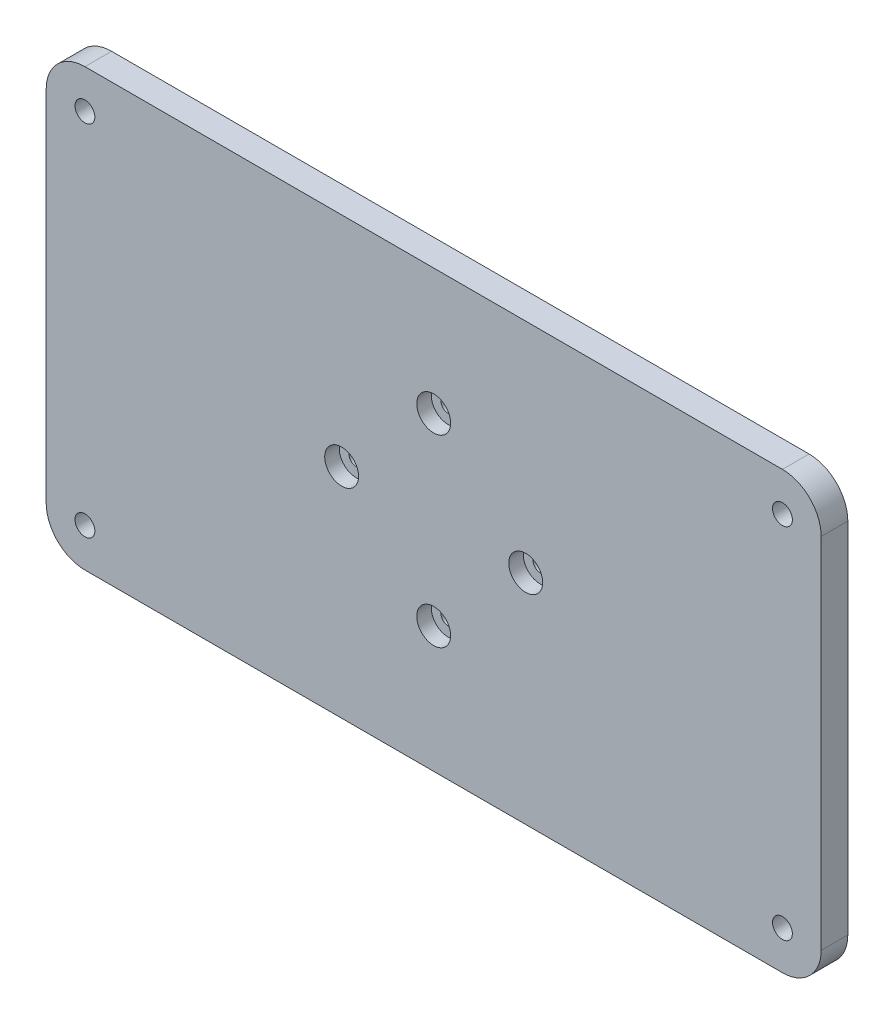
from build123d import *

# Parameters (mm, degrees)
SKETCH_1_R          = 28.7
SKETCH_1_R_2        = 1.5
EXTRUDE_1_DEPTH     = 3
EXTRUDE_START       = -48
SKETCH_2_R          = 34.7
SKETCH_2_R_2        = 28.7
EXTRUDE_2_DEPTH     = 48
SKETCH_3_W          = 12
SKETCH_3_H          = 23
CUT_EXTRUDE_1_DEPTH = 10
FILLET_1_R          = 2
SKETCH_4_W          = 30
SKETCH_4_H          = 25
CUT_EXTRUDE_2_DEPTH = 96.094431221
FILLET_2_R          = 2
SKETCH_5_W          = 160
SKETCH_5_H          = 90
SKETCH_5_R          = 34.7
SKETCH_5_R_2        = 1.5
EXTRUDE_3_DEPTH     = 5.5
SKETCH_7_R          = 2.05
CUT_EXTRUDE_3_DEPTH = 104.580886314
FILLET_4_R          = 8
CUT_EXTRUDE_START   = -3
SKETCH_8_R          = 3.5
SKETCH_8_R_2        = 1.5
CUT_EXTRUDE_4_DEPTH = 3
SKETCH_9_R          = 34.7
CUT_EXTRUDE_5_DEPTH = 48


with BuildPart() as part:
    # 草图1 → 凸台-拉伸1 (new body)
    with BuildSketch(Plane.XY):
        Circle(SKETCH_1_R)
        with Locations((0, 19)):
            Circle(SKETCH_1_R_2, mode=Mode.SUBTRACT)
        with Locations((19, 0)):
            Circle(SKETCH_1_R_2, mode=Mode.SUBTRACT)
        with Locations((0, -19)):
            Circle(SKETCH_1_R_2, mode=Mode.SUBTRACT)
        with Locations((-19, 0)):
            Circle(SKETCH_1_R_2, mode=Mode.SUBTRACT)
    extrude(amount=EXTRUDE_1_DEPTH)

    # 草图2 → 凸台-拉伸2 (add)
    with BuildSketch(Plane.XY.offset(3).offset(EXTRUDE_START)):
        Circle(SKETCH_2_R)
        Circle(SKETCH_2_R_2, mode=Mode.SUBTRACT)
    extrude(amount=EXTRUDE_2_DEPTH)

    # 草图3 → 切除-拉伸1 (cut)
    with BuildSketch(Plane(origin=(-24.536605307, 24.536605307, 0), x_dir=(0, 0, 1), z_dir=(-0.7071067811865488, 0.7071067811865464, 0))):
        with Locations((-6, 0)):
            Rectangle(SKETCH_3_W, SKETCH_3_H)
    extrude(amount=-CUT_EXTRUDE_1_DEPTH, mode=Mode.SUBTRACT)

    # 圆角1
    fillet_1_edges = [part.edges().sort_by_distance(p)[0] for p in [
        (-12.740018652, 29.00347462, -12),
        (-12.740018652, 29.00347462, 0),
        (-29.00347462, 12.740018652, 0),
        (-29.00347462, 12.740018652, -12),
    ]]
    fillet(fillet_1_edges, radius=FILLET_1_R)

    # 草图4 → 切除-拉伸2 (cut, through all)
    with BuildSketch(Plane(origin=(24.536605307, 24.536605307, 0), x_dir=(0.7071067811865487, -0.7071067811865465, 0), z_dir=(0.7071067811865465, 0.7071067811865487, 0))):
        with Locations((0.808951296, 22.5)):
            Rectangle(SKETCH_4_W, SKETCH_4_H)
    extrude(amount=-CUT_EXTRUDE_2_DEPTH, mode=Mode.SUBTRACT)

    # 圆角2
    fillet_2_edges = [part.edges().sort_by_distance(p)[0] for p in [
        (-8.211322504, -30.568555834, -35),
        (30.568555834, 8.211322504, -35),
        (-8.211322504, -30.568555834, -10),
        (30.568555834, 8.211322504, -10),
        (-30.049784568, -9.980611027, -10),
        (9.980611027, 30.049784568, -10),
        (-30.049784568, -9.980611027, -35),
        (9.980611027, 30.049784568, -35),
    ]]
    fillet(fillet_2_edges, radius=FILLET_2_R)

    # 草图5 → 凸台-拉伸3 (add)
    # profile 1 of 2: a face of its own
    with BuildSketch(Plane.XY.offset(3)):
        Rectangle(SKETCH_5_W, SKETCH_5_H)
        Circle(SKETCH_5_R, mode=Mode.SUBTRACT)
    # profile 2 of 2: a face of its own
    with BuildSketch(Plane.XY.offset(3)):
        Circle(SKETCH_5_R)
        with Locations((0, 19)):
            Circle(SKETCH_5_R_2, mode=Mode.SUBTRACT)
        with Locations((-19, 0)):
            Circle(SKETCH_5_R_2, mode=Mode.SUBTRACT)
        with Locations((19, 0)):
            Circle(SKETCH_5_R_2, mode=Mode.SUBTRACT)
        with Locations((0, -19)):
            Circle(SKETCH_5_R_2, mode=Mode.SUBTRACT)
    extrude(amount=EXTRUDE_3_DEPTH)

    # 草图7 → 切除-拉伸3 (cut, through all)
    with BuildSketch(Plane(origin=(0, 0, 3), x_dir=(-1, 0, 0), z_dir=(0, 0, -1))):
        with Locations((-72, 37)):
            Circle(SKETCH_7_R)
        with Locations((72, 37)):
            Circle(SKETCH_7_R)
        with Locations((72, -37)):
            Circle(SKETCH_7_R)
        with Locations((-72, -37)):
            Circle(SKETCH_7_R)
    extrude(amount=-CUT_EXTRUDE_3_DEPTH, mode=Mode.SUBTRACT)

    # 圆角4
    fillet_4_edges = [part.edges().sort_by_distance(p)[0] for p in [
        (80, -45, 5.75),
        (80, 45, 5.75),
        (-80, 45, 5.75),
        (-80, -45, 5.75),
    ]]
    fillet(fillet_4_edges, radius=FILLET_4_R)

    # 草图8 → 切除-拉伸4 (cut)
    # profile 1 of 4: a face of its own
    with BuildSketch(Plane.XY.offset(8.5).offset(CUT_EXTRUDE_START)):
        with Locations((-19, 0)):
            Circle(SKETCH_8_R)
        with Locations((-19, 0)):
            Circle(SKETCH_8_R_2, mode=Mode.SUBTRACT)
    # profile 2 of 4: a face of its own
    with BuildSketch(Plane.XY.offset(8.5).offset(CUT_EXTRUDE_START)):
        with Locations((0, 19)):
            Circle(SKETCH_8_R)
    # profile 3 of 4: a face of its own
    with BuildSketch(Plane.XY.offset(8.5).offset(CUT_EXTRUDE_START)):
        with Locations((19, 0)):
            Circle(SKETCH_8_R)
    # profile 4 of 4: a face of its own
    with BuildSketch(Plane.XY.offset(8.5).offset(CUT_EXTRUDE_START)):
        with Locations((0, -19)):
            Circle(SKETCH_8_R)
    extrude(amount=CUT_EXTRUDE_4_DEPTH, mode=Mode.SUBTRACT)

    # 草图9 → 切除-拉伸5 (cut)
    with BuildSketch(Plane(origin=(0, 0, -45), x_dir=(-1, 0, 0), z_dir=(0, 0, -1))):
        Circle(SKETCH_9_R)
    extrude(amount=-CUT_EXTRUDE_5_DEPTH, mode=Mode.SUBTRACT)


solid = part.part
